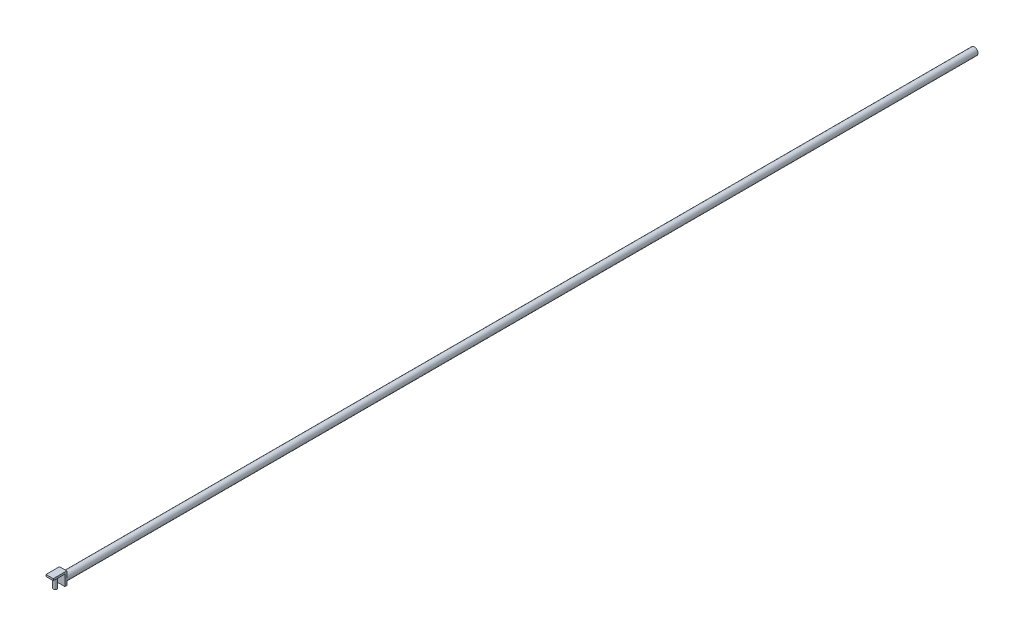
from build123d import *

# Parameters (mm, degrees)
SKETCH_1_W      = 2
SKETCH_1_H      = 3
EXTRUDE_1_DEPTH = 0.5
SKETCH_2_W      = 2
SKETCH_2_H      = 3.7
EXTRUDE_2_DEPTH = 0.5
SKETCH_3_R      = 1
EXTRUDE_3_DEPTH = 250
SKETCH_4_R      = 0.5
EXTRUDE_4_DEPTH = 3


with BuildPart() as part:
    # 草图1 → 凸台-拉伸1 (new body)
    with BuildSketch(Plane.XY):
        Rectangle(SKETCH_1_W, SKETCH_1_H)
    extrude(amount=EXTRUDE_1_DEPTH)

    # 草图2 → 凸台-拉伸2 (add)
    with BuildSketch(Plane(origin=(0, 1.5, 0), x_dir=(1, 0, 0), z_dir=(0, 1, 0))):
        with Locations((0, -1.85)):
            Rectangle(SKETCH_2_W, SKETCH_2_H)
    extrude(amount=EXTRUDE_2_DEPTH)

    # 草图3 → 凸台-拉伸3 (add)
    with BuildSketch(Plane(origin=(0, 0, 0), x_dir=(-1, 0, 0), z_dir=(0, 0, -1))):
        Circle(SKETCH_3_R)
    extrude(amount=EXTRUDE_3_DEPTH)

    # 草图4 → 凸台-拉伸4 (add)
    with BuildSketch(Plane.XZ.offset(-1.5)):
        with Locations(Location((0, 2.2, 0), (0, 0, 90))):
            Circle(SKETCH_4_R)
    extrude(amount=EXTRUDE_4_DEPTH)


solid = part.part
